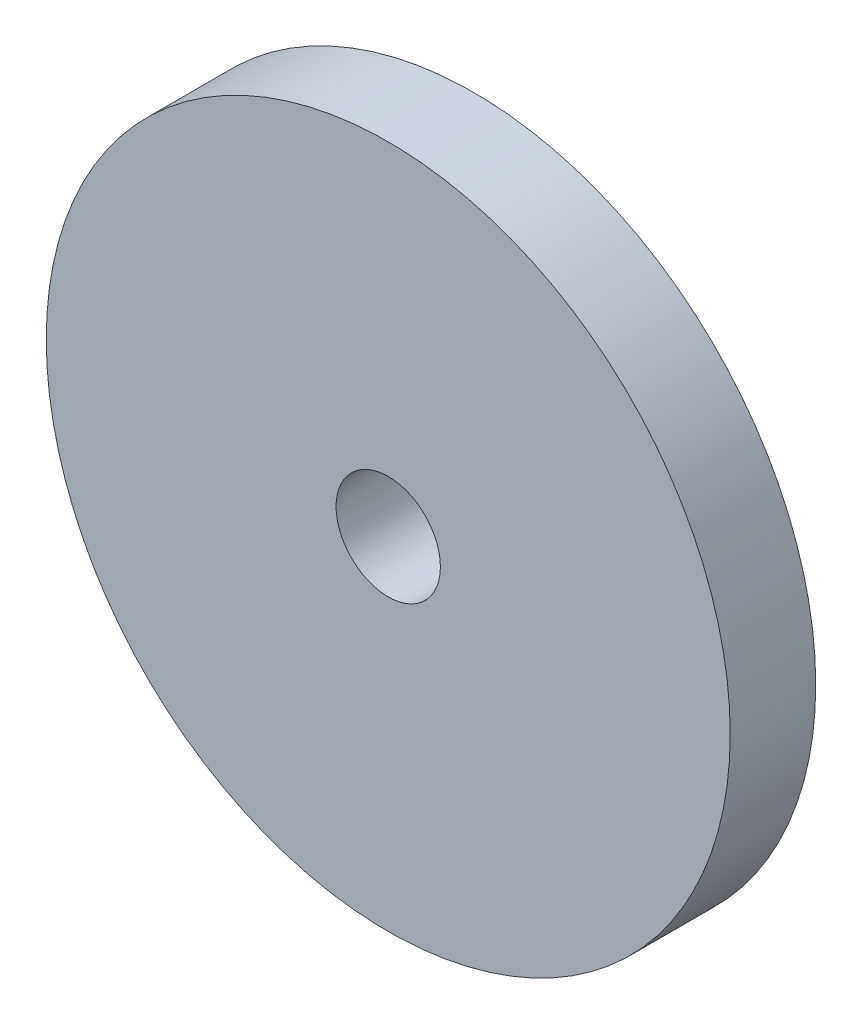
from build123d import *

# Parameters (mm, degrees)
SKETCH1_R           = 20
SKETCH1_R_2         = 3.05
BOSS_EXTRUDE1_DEPTH = 5


with BuildPart() as part:
    # Sketch1 → Boss-Extrude1 (new body)
    with BuildSketch(Plane.XY):
        Circle(SKETCH1_R)
        Circle(SKETCH1_R_2, mode=Mode.SUBTRACT)
    extrude(amount=BOSS_EXTRUDE1_DEPTH)


solid = part.part
